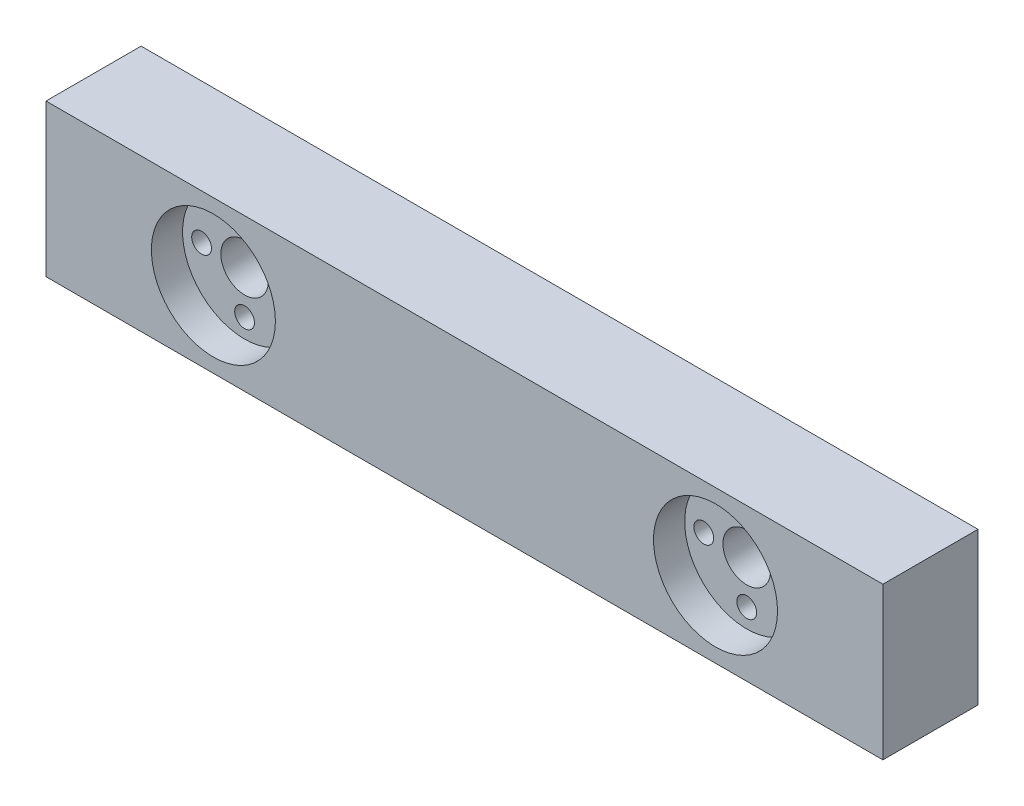
from build123d import *

# Parameters (mm, degrees)
SKETCH1_W           = 11000
SKETCH1_H           = 2000
BOSS_EXTRUDE1_DEPTH = 1250
SKETCH2_R           = 815
CUT_EXTRUDE2_DEPTH  = 410
SKETCH23_R          = 312.5
CUT_EXTRUDE3_DEPTH  = 11251
SKETCH24_R          = 130
CUT_EXTRUDE4_DEPTH  = 11251
SKETCH25_R          = 130
CUT_EXTRUDE5_DEPTH  = 11251
SCALE1_SCALE        = 0.025


with BuildPart() as part:
    # Sketch1 → Boss-Extrude1 (new body)
    with BuildSketch(Plane.XY):
        with Locations((5500, 1000)):
            Rectangle(SKETCH1_W, SKETCH1_H)
    extrude(amount=-BOSS_EXTRUDE1_DEPTH)

    # Sketch2 → Cut-Extrude2 (cut)
    with BuildSketch(Plane.XY):
        with Locations((2200, 1000)):
            Circle(SKETCH2_R)
        with Locations((8800, 1000)):
            Circle(SKETCH2_R)
    extrude(amount=-CUT_EXTRUDE2_DEPTH, mode=Mode.SUBTRACT)

    # Sketch23 → Cut-Extrude3 (cut, through all)
    with BuildSketch(Plane.XY):
        with Locations((2200, 1000)):
            Circle(SKETCH23_R)
        with Locations((8800, 1000)):
            Circle(SKETCH23_R)
    extrude(amount=-CUT_EXTRUDE3_DEPTH, mode=Mode.SUBTRACT)

    # Sketch24 → Cut-Extrude4 (cut, through all)
    with BuildSketch(Plane.XY):
        with Locations((2200, 435)):
            Circle(SKETCH24_R)
        with Locations((1635, 1000)):
            Circle(SKETCH24_R)
        with Locations((2200, 1565)):
            Circle(SKETCH24_R)
        with Locations((2765, 1000)):
            Circle(SKETCH24_R)
    extrude(amount=-CUT_EXTRUDE4_DEPTH, mode=Mode.SUBTRACT)

    # Sketch25 → Cut-Extrude5 (cut, through all)
    with BuildSketch(Plane.XY):
        with Locations((8800, 435)):
            Circle(SKETCH25_R)
        with Locations((8235, 1000)):
            Circle(SKETCH25_R)
        with Locations((8800, 1565)):
            Circle(SKETCH25_R)
        with Locations((9365, 1000)):
            Circle(SKETCH25_R)
    extrude(amount=-CUT_EXTRUDE5_DEPTH, mode=Mode.SUBTRACT)


with BuildPart() as part_1:
    # Scale1: scaled about (5500, 1000, -646.66686697)
    add(part.part.scale(SCALE1_SCALE).moved(Location((5362.5, 975, -630.500195296))))


solid = part_1.part
